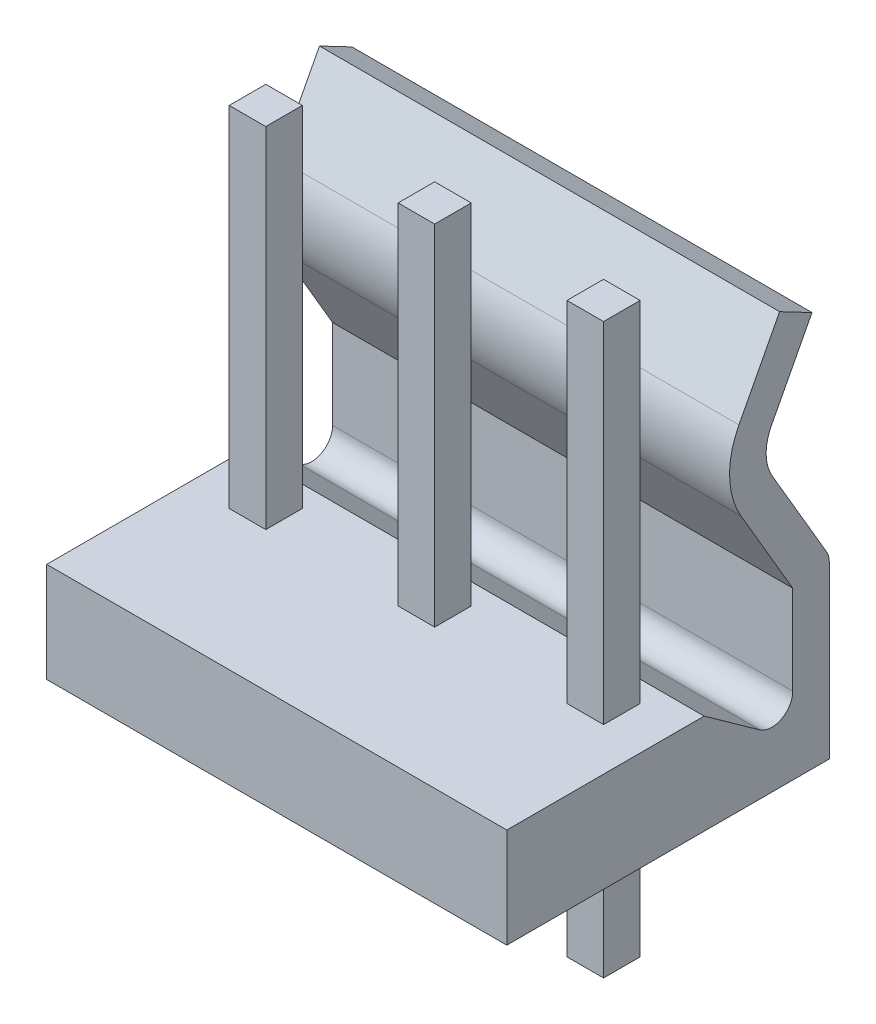
from build123d import *

# Parameters (mm, degrees)
CROQUIS1_W                   = 13.84
CROQUIS1_H                   = 9.7
CROQUIS1_W_2                 = 1.1
CROQUIS1_H_2                 = 1.1
SALIENTE_EXTRUIR1_DEPTH      = 3
CROQUIS2_W                   = 13.84
CROQUIS2_H                   = 3
SALIENTE_EXTRUIR2_DEPTH      = 9.4
CORTAR_EXTRUIR1_DEPTH        = 16.490841585
SALIENTE_EXTRUIR3_DEPTH      = 13.5
SALIENTE_EXTRUIR3_DEPTH_BACK = 3.6
CROQUIS5_W                   = 1.1
CROQUIS5_H                   = 1.1


with BuildPart() as part:
    # Croquis1 → Saliente-Extruir1 (new body)
    with BuildSketch(Plane(origin=(0, 0, 0), x_dir=(1, 0, 0), z_dir=(0, 1, 0))):
        with Locations((5.08, 0.1)):
            Rectangle(CROQUIS1_W, CROQUIS1_H)
        Rectangle(CROQUIS1_W_2, CROQUIS1_H_2, mode=Mode.SUBTRACT)
        with Locations((10.16, 0)):
            Rectangle(CROQUIS1_W_2, CROQUIS1_H_2, mode=Mode.SUBTRACT)
        with Locations((5.08, 0)):
            Rectangle(CROQUIS1_W_2, CROQUIS1_H_2, mode=Mode.SUBTRACT)
    extrude(amount=SALIENTE_EXTRUIR1_DEPTH)

    # Croquis2 → Saliente-Extruir2 (add)
    with BuildSketch(Plane(origin=(0, 3, 0), x_dir=(1, 0, 0), z_dir=(0, 1, 0))):
        with Locations((5.08, 3.45)):
            Rectangle(CROQUIS2_W, CROQUIS2_H)
    extrude(amount=SALIENTE_EXTRUIR2_DEPTH)

    # Croquis3 → Cortar-Extruir1 (cut)
    with BuildSketch(Plane.ZY.offset(1.84)):
        with BuildLine():
            Line((-4.95, 12.4), (-4.95, 5.130923429))
            ThreePointArc((-4.95, 5.130923429), (-4.928460036, 5.292584893), (-4.865343077, 5.442966568))
            Line((-4.865343077, 5.442966568), (-3.238584298, 8.220392257))
            ThreePointArc((-3.238584298, 8.220392257), (-3.050389859, 8.882763545), (-3.206840185, 9.553342522))
            Line((-3.206840185, 9.553342522), (-4.429874218, 11.889875107))
            Line((-4.429874218, 11.889875107), (-3.455311447, 12.4))
            Line((-3.455311447, 12.4), (-4.95, 12.4))
        make_face()
        with BuildLine():
            Line((-1.95, 12.4), (-3.455311447, 12.4))
            Line((-3.455311447, 12.4), (-2.232277415, 10.063467416))
            ThreePointArc((-2.232277415, 10.063467416), (-2.021605007, 9.506586156), (-1.95, 8.9155089))
            Line((-1.95, 8.9155089), (-1.95, 12.4))
        make_face()
        with BuildLine():
            Line((-1.95, 3), (-1.95, 8.9155089))
            ThreePointArc((-1.95, 8.9155089), (-2.036358841, 8.267369623), (-2.28940975, 7.664453701))
            Line((-2.28940975, 7.664453701), (-3.85, 5))
            Line((-3.85, 5), (-3.85, 2.319959731))
            ThreePointArc((-3.85, 2.319959731), (-3.508458272, 1.760049187), (-2.854318236, 1.807497933))
            Line((-2.854318236, 1.807497933), (-1.184444515, 3))
            Line((-1.184444515, 3), (-1.95, 3))
        make_face()
    extrude(amount=-CORTAR_EXTRUIR1_DEPTH, mode=Mode.SUBTRACT)

    # Croquis5 → Saliente-Extruir3 (add, two sides: drawn at the far end of the back side and taken through both)
    with BuildSketch(Plane(origin=(0, 0, 0), x_dir=(1, 0, 0), z_dir=(0, 1, 0)).offset(-SALIENTE_EXTRUIR3_DEPTH_BACK)):
        with Locations((10.16, 0)):
            Rectangle(CROQUIS5_W, CROQUIS5_H)
        Rectangle(CROQUIS5_W, CROQUIS5_H)
        with Locations((5.08, 0)):
            Rectangle(CROQUIS5_W, CROQUIS5_H)
    extrude(amount=SALIENTE_EXTRUIR3_DEPTH + SALIENTE_EXTRUIR3_DEPTH_BACK)


solid = part.part
